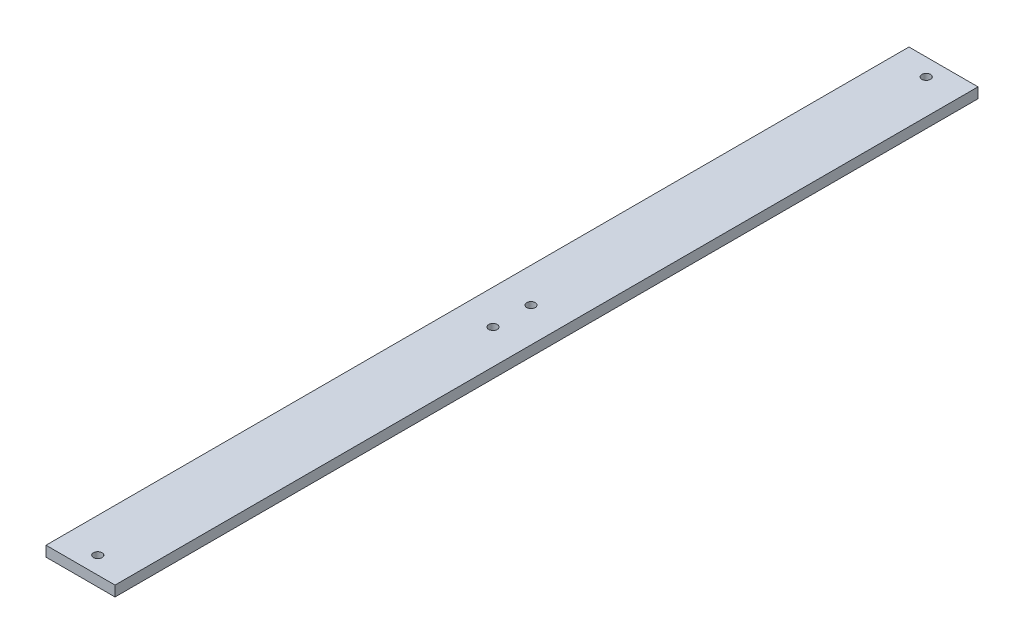
from build123d import *

# Parameters (mm, degrees)
SKETCH1_W           = 40
SKETCH1_H           = 6
BOSS_EXTRUDE1_DEPTH = 500
SKETCH2_R           = 2.5
CUT_EXTRUDE1_DEPTH  = 10
LPATTERN1_COUNT     = 2
LPATTERN1_PITCH     = 480
SKETCH3_R           = 2.5
CUT_EXTRUDE2_DEPTH  = 10
LPATTERN2_COUNT     = 2
LPATTERN2_PITCH     = 22


with BuildPart() as part:
    # Sketch1 → Boss-Extrude1 (new body)
    with BuildSketch(Plane.XY):
        with Locations((20, 3)):
            Rectangle(SKETCH1_W, SKETCH1_H)
    extrude(amount=BOSS_EXTRUDE1_DEPTH)

    # Sketch2 → Cut-Extrude1 (cut)
    with BuildSketch(Plane(origin=(0, 6, 0), x_dir=(1, 0, 0), z_dir=(0, 1, 0))):
        with Locations(Location((20, -10, 0), (0, 0, 270))):
            Circle(SKETCH2_R)
    cut_extrude1 = extrude(amount=-CUT_EXTRUDE1_DEPTH, mode=Mode.SUBTRACT)

    # LPattern1: Cut-Extrude1 ×2
    with Locations(*[(0, 0, i * LPATTERN1_PITCH) for i in range(1, LPATTERN1_COUNT)]):
        add(cut_extrude1, mode=Mode.SUBTRACT)

    # Sketch3 → Cut-Extrude2 (cut)
    with BuildSketch(Plane(origin=(0, 6, 0), x_dir=(1, 0, 0), z_dir=(0, 1, 0))):
        with Locations(Location((20, -239, 0), (0, 0, 270))):
            Circle(SKETCH3_R)
    cut_extrude2 = extrude(amount=-CUT_EXTRUDE2_DEPTH, mode=Mode.SUBTRACT)

    # LPattern2: Cut-Extrude2 ×2
    with Locations(*[(0, 0, i * LPATTERN2_PITCH) for i in range(1, LPATTERN2_COUNT)]):
        add(cut_extrude2, mode=Mode.SUBTRACT)


solid = part.part
